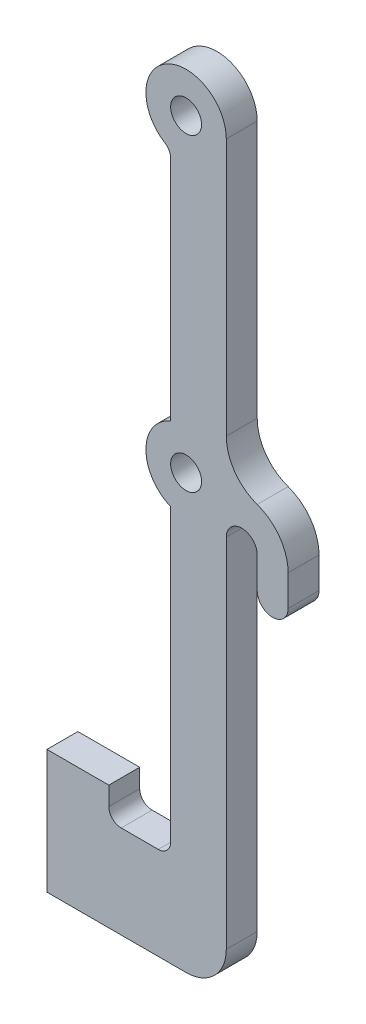
from build123d import *

# Parameters (mm, degrees)
SKETCH1_R           = 3.175
BOSS_EXTRUDE1_DEPTH = 3.175
FILLET1_R           = 2.54
BOSS_EXTRUDE2_DEPTH = 6.35


with BuildPart() as part:
    # Sketch1 → Boss-Extrude1 (new, symmetric)
    with BuildSketch(Plane.XY):
        with BuildLine():
            Line((8.255, 0), (8.255, -144.145))
            ThreePointArc((8.255, -144.145), (5.837166479, -149.982166479), (0, -152.4))
            Line((0, -152.4), (-28.575, -152.4))
            Line((-28.575, -152.4), (-28.575, -127))
            Line((-28.575, -127), (-15.875, -127))
            Line((-15.875, -127), (-15.875, -130.81))
            ThreePointArc((-15.875, -130.81), (-15.131051224, -132.606051224), (-13.335, -133.35))
            Line((-13.335, -133.35), (-5.715, -133.35))
            ThreePointArc((-5.715, -133.35), (-3.918948776, -132.606051224), (-3.175, -130.81))
            Line((-3.175, -130.81), (-3.175, -71.12))
            ThreePointArc((-3.175, -71.12), (-8.255, -63.5), (-3.175, -55.88))
            Line((-3.175, -55.88), (-3.175, -7.62))
            ThreePointArc((-3.175, -7.62), (-4.57905012, 6.86857518), (8.255, 0))
        make_face()
        Circle(SKETCH1_R, mode=Mode.SUBTRACT)
        with Locations((0, -63.5)):
            Circle(SKETCH1_R, mode=Mode.SUBTRACT)
    extrude(amount=BOSS_EXTRUDE1_DEPTH, both=True)

    # Fillet1
    fillet1_edges = [part.edges().sort_by_distance(p)[0] for p in [
        (-3.175, -7.62, 0),
    ]]
    fillet(fillet1_edges, radius=FILLET1_R)

    # Sketch2 → Boss-Extrude2 (add)
    with BuildSketch(Plane.XY.offset(3.175)):
        with BuildLine():
            Line((14.605, -70.822423777), (14.605, -77.172423777))
            ThreePointArc((14.605, -77.172423777), (17.78, -80.347423777), (20.955, -77.172423777))
            Line((20.955, -77.172423777), (20.955, -70.822423777))
            ThreePointArc((20.955, -70.822423777), (19.207129933, -65.323162463), (14.605, -61.842167656))
            ThreePointArc((14.605, -61.842167656), (10.002870067, -58.361172848), (8.255, -52.861911534))
            Line((8.255, -52.861911534), (8.255, -70.822423777))
            ThreePointArc((8.255, -70.822423777), (11.43, -67.647423777), (14.605, -70.822423777))
        make_face()
    extrude(amount=-BOSS_EXTRUDE2_DEPTH)


solid = part.part
